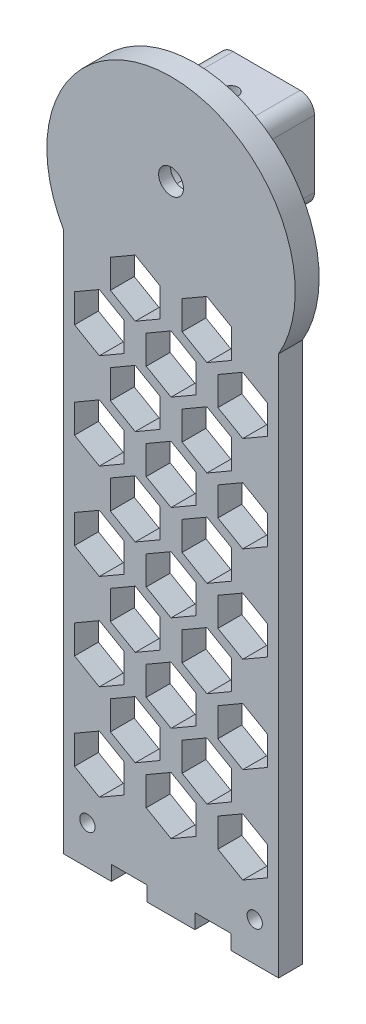
from build123d import *

# Parameters (mm, degrees)
EXTRUDE_1_DEPTH     = 5
SKETCH_2_R          = 1.6
SKETCH_2_W          = 7.5
SKETCH_2_H          = 3.1
CUT_EXTRUDE_1_DEPTH = 5
EXTRUDE_START       = -2.5
SKETCH_3_R          = 2.6
EXTRUDE_2_DEPTH     = 2.5
EXTRUDE_START_2     = 15
SKETCH_4_W          = 20
SKETCH_4_H          = 20
EXTRUDE_3_DEPTH     = 15
CUT_EXTRUDE_2_REACH = 135.15
SKETCH_5_R          = 1.55
FILLET_2_R          = 3


with BuildPart() as part:
    # 草图1 → 凸台-拉伸1 (new body)
    with BuildSketch(Plane.XY):
        with BuildLine():
            Line((0, 0), (45, 0))
            Line((45, 0), (45, 113.1))
            ThreePointArc((45, 113.1), (22.5, 152.07114317), (0, 113.1))
            Line((0, 113.1), (0, 0))
        make_face()
        with BuildLine():
            Line((19.44, 129.02), (25.56, 129.02))
            ThreePointArc((25.56, 129.02), (22.5, 138.2), (19.44, 129.02))
        make_face(mode=Mode.SUBTRACT)
    extrude(amount=EXTRUDE_1_DEPTH)

    # 草图2 → 切除-拉伸1 (cut)
    with BuildSketch(Plane.XY.offset(5)):
        with Locations((40, 8.1)):
            Circle(SKETCH_2_R)
        with Locations((5, 8.1)):
            Circle(SKETCH_2_R)
        with Locations((31.25, 1.55)):
            Rectangle(SKETCH_2_W, SKETCH_2_H)
        with Locations((13.75, 1.55)):
            Rectangle(SKETCH_2_W, SKETCH_2_H)
        Polygon((7.5, 26), (2.303847577, 23), (2.303847577, 17), (7.5, 14), (12.696152423, 17), (12.696152423, 23), align=None)
        Polygon((22.5, 26), (17.303847577, 23), (17.303847577, 17), (22.5, 14), (27.696152423, 17), (27.696152423, 23), align=None)
        Polygon((37.5, 26), (32.303847577, 23), (32.303847577, 17), (37.5, 14), (42.696152423, 17), (42.696152423, 23), align=None)
        Polygon((15, 56), (9.803847577, 53), (9.803847577, 47), (15, 44), (20.196152423, 47), (20.196152423, 53), align=None)
        Polygon((15, 36), (9.803847577, 33), (9.803847577, 27), (15, 24), (20.196152423, 27), (20.196152423, 33), align=None)
        Polygon((30, 36), (24.803847577, 33), (24.803847577, 27), (30, 24), (35.196152423, 27), (35.196152423, 33), align=None)
        Polygon((30, 56), (24.803847577, 53), (24.803847577, 47), (30, 44), (35.196152423, 47), (35.196152423, 53), align=None)
        Polygon((37.5, 46), (32.303847577, 43), (32.303847577, 37), (37.5, 34), (42.696152423, 37), (42.696152423, 43), align=None)
        Polygon((22.5, 46), (17.303847577, 43), (17.303847577, 37), (22.5, 34), (27.696152423, 37), (27.696152423, 43), align=None)
        Polygon((7.5, 46), (2.303847577, 43), (2.303847577, 37), (7.5, 34), (12.696152423, 37), (12.696152423, 43), align=None)
        Polygon((15, 76), (9.803847577, 73), (9.803847577, 67), (15, 64), (20.196152423, 67), (20.196152423, 73), align=None)
        Polygon((30, 76), (24.803847577, 73), (24.803847577, 67), (30, 64), (35.196152423, 67), (35.196152423, 73), align=None)
        Polygon((37.5, 66), (32.303847577, 63), (32.303847577, 57), (37.5, 54), (42.696152423, 57), (42.696152423, 63), align=None)
        Polygon((22.5, 66), (17.303847577, 63), (17.303847577, 57), (22.5, 54), (27.696152423, 57), (27.696152423, 63), align=None)
        Polygon((7.5, 66), (2.303847577, 63), (2.303847577, 57), (7.5, 54), (12.696152423, 57), (12.696152423, 63), align=None)
        Polygon((15, 96), (9.803847577, 93), (9.803847577, 87), (15, 84), (20.196152423, 87), (20.196152423, 93), align=None)
        Polygon((30, 96), (24.803847577, 93), (24.803847577, 87), (30, 84), (35.196152423, 87), (35.196152423, 93), align=None)
        Polygon((37.5, 86), (32.303847577, 83), (32.303847577, 77), (37.5, 74), (42.696152423, 77), (42.696152423, 83), align=None)
        Polygon((22.5, 86), (17.303847577, 83), (17.303847577, 77), (22.5, 74), (27.696152423, 77), (27.696152423, 83), align=None)
        Polygon((7.5, 86), (2.303847577, 83), (2.303847577, 77), (7.5, 74), (12.696152423, 77), (12.696152423, 83), align=None)
        Polygon((15, 116), (9.803847577, 113), (9.803847577, 107), (15, 104), (20.196152423, 107), (20.196152423, 113), align=None)
        Polygon((30, 116), (24.803847577, 113), (24.803847577, 107), (30, 104), (35.196152423, 107), (35.196152423, 113), align=None)
        Polygon((37.5, 106), (32.303847577, 103), (32.303847577, 97), (37.5, 94), (42.696152423, 97), (42.696152423, 103), align=None)
        Polygon((22.5, 106), (17.303847577, 103), (17.303847577, 97), (22.5, 94), (27.696152423, 97), (27.696152423, 103), align=None)
        Polygon((7.5, 106), (2.303847577, 103), (2.303847577, 97), (7.5, 94), (12.696152423, 97), (12.696152423, 103), align=None)
    extrude(amount=-CUT_EXTRUDE_1_DEPTH, mode=Mode.SUBTRACT)

    # 草图3 → 凸台-拉伸2 (add)
    with BuildSketch(Plane.XY.offset(5).offset(EXTRUDE_START)):
        with BuildLine():
            Line((19.44, 129.02), (25.56, 129.02))
            ThreePointArc((25.56, 129.02), (22.5, 138.2), (19.44, 129.02))
        make_face()
        with Locations((22.5, 133.1)):
            Circle(SKETCH_3_R, mode=Mode.SUBTRACT)
    extrude(amount=EXTRUDE_2_DEPTH)

    # 草图4 → 凸台-拉伸3 (add)
    with BuildSketch(Plane(origin=(0, 0, 0), x_dir=(-1, 0, 0), z_dir=(0, 0, -1)).offset(EXTRUDE_START_2)):
        with Locations((-22.5, 133.1)):
            Rectangle(SKETCH_4_W, SKETCH_4_H)
        with BuildLine():
            Line((-25.56, 129.02), (-19.44, 129.02))
            ThreePointArc((-19.44, 129.02), (-22.5, 138.2), (-25.56, 129.02))
        make_face(mode=Mode.SUBTRACT)
    extrude(amount=-EXTRUDE_3_DEPTH)

    # 切除-拉伸2: up to this face of the body (flat: up to its plane)
    cut_extrude_2_end = Plane(part.part.faces().sort_by_distance((22.5, 143.1, -7.5))[0])
    # 草图5 → 切除-拉伸2 (cut, up to the picked face)
    with BuildSketch(Plane.XZ.offset(-123.1), mode=Mode.PRIVATE) as cut_extrude_2_sk1:
        with Locations(Location((22.5, -7.5, 0), (0, 0, 270))):
            Circle(SKETCH_5_R)
    cut_extrude_2_tool1 = split(extrude(cut_extrude_2_sk1.sketch, amount=-CUT_EXTRUDE_2_REACH, mode=Mode.PRIVATE), bisect_by=cut_extrude_2_end, keep=Keep.BOTH, mode=Mode.PRIVATE)
    add(cut_extrude_2_tool1.solids().sort_by(Axis((22.5, 123.1, -7.5), (0, 1, 0)))[0], mode=Mode.SUBTRACT)

    # 圆角2
    fillet_2_edges = [part.edges().sort_by_distance(p)[0] for p in [
        (32.5, 133.1, 0),
        (32.5, 143.1, -7.5),
        (22.5, 123.1, 0),
        (32.5, 123.1, -7.5),
        (12.5, 133.1, 0),
        (12.5, 123.1, -7.5),
        (22.5, 143.1, 0),
        (12.5, 143.1, -7.5),
    ]]
    fillet(fillet_2_edges, radius=FILLET_2_R)


solid = part.part
